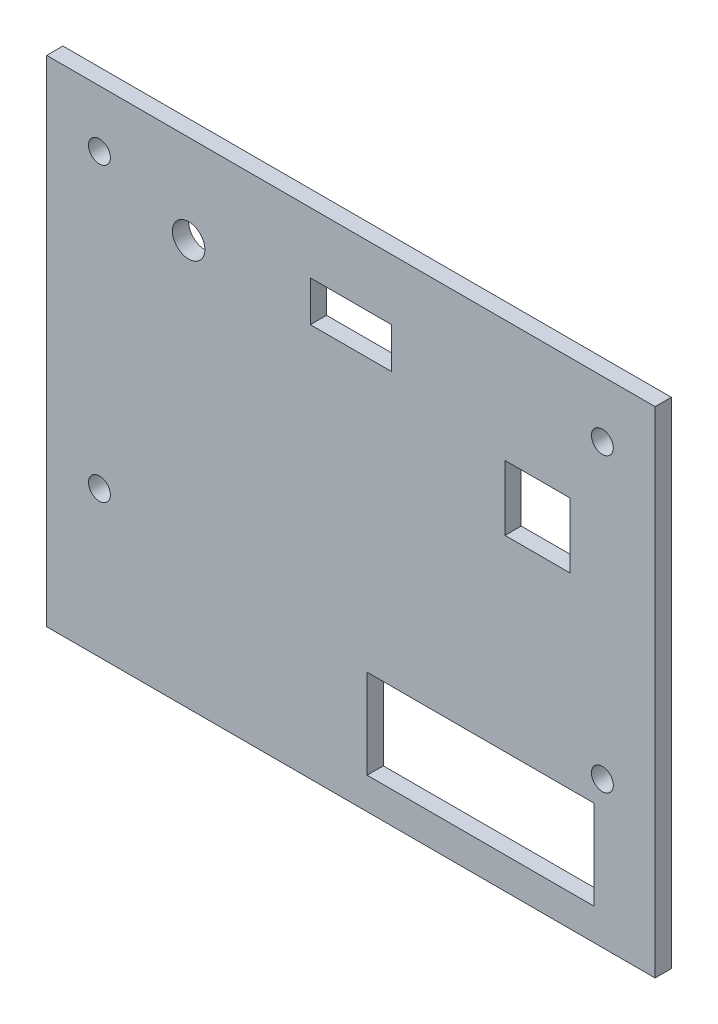
from build123d import *

# Parameters (mm, degrees)
SKETCH_1_W          = 75
SKETCH_1_H          = 61
EXTRUDE_1_DEPTH     = 2
SKETCH_2_W          = 28
SKETCH_2_H          = 11
CUT_EXTRUDE_1_DEPTH = 97.695398029
SKETCH_3_W          = 10
SKETCH_3_H          = 5
SKETCH_3_W_2        = 8
SKETCH_3_H_2        = 8
CUT_EXTRUDE_2_DEPTH = 97.695398029
SKETCH_4_R          = 1.35
CUT_EXTRUDE_3_DEPTH = 97.695398029
SKETCH_5_R          = 2
CUT_EXTRUDE_4_DEPTH = 97.695398029


with BuildPart() as part:
    # 草图1 → 凸台-拉伸1 (new body)
    with BuildSketch(Plane.XY):
        with Locations((37.5, 30.5)):
            Rectangle(SKETCH_1_W, SKETCH_1_H)
    extrude(amount=EXTRUDE_1_DEPTH)

    # 草图2 → 切除-拉伸1 (cut, through all)
    with BuildSketch(Plane.XY):
        with Locations((53.5, 9.4)):
            Rectangle(SKETCH_2_W, SKETCH_2_H)
    extrude(amount=CUT_EXTRUDE_1_DEPTH, mode=Mode.SUBTRACT)

    # 草图3 → 切除-拉伸2 (cut, through all)
    with BuildSketch(Plane.XY):
        with Locations((37.5, 51)):
            Rectangle(SKETCH_3_W, SKETCH_3_H)
        with Locations((60.5, 42)):
            Rectangle(SKETCH_3_W_2, SKETCH_3_H_2)
    extrude(amount=CUT_EXTRUDE_2_DEPTH, mode=Mode.SUBTRACT)

    # 草图4 → 切除-拉伸3 (cut, through all)
    with BuildSketch(Plane.XY):
        with Locations((6.5, 18)):
            Circle(SKETCH_4_R)
        with Locations((68.5, 18)):
            Circle(SKETCH_4_R)
        with Locations((6.5, 54)):
            Circle(SKETCH_4_R)
        with Locations((68.5, 54)):
            Circle(SKETCH_4_R)
    extrude(amount=CUT_EXTRUDE_3_DEPTH, mode=Mode.SUBTRACT)

    # 草图5 → 切除-拉伸4 (cut, through all)
    with BuildSketch(Plane.XY):
        with Locations((17.5, 50)):
            Circle(SKETCH_5_R)
    extrude(amount=CUT_EXTRUDE_4_DEPTH, mode=Mode.SUBTRACT)


solid = part.part
